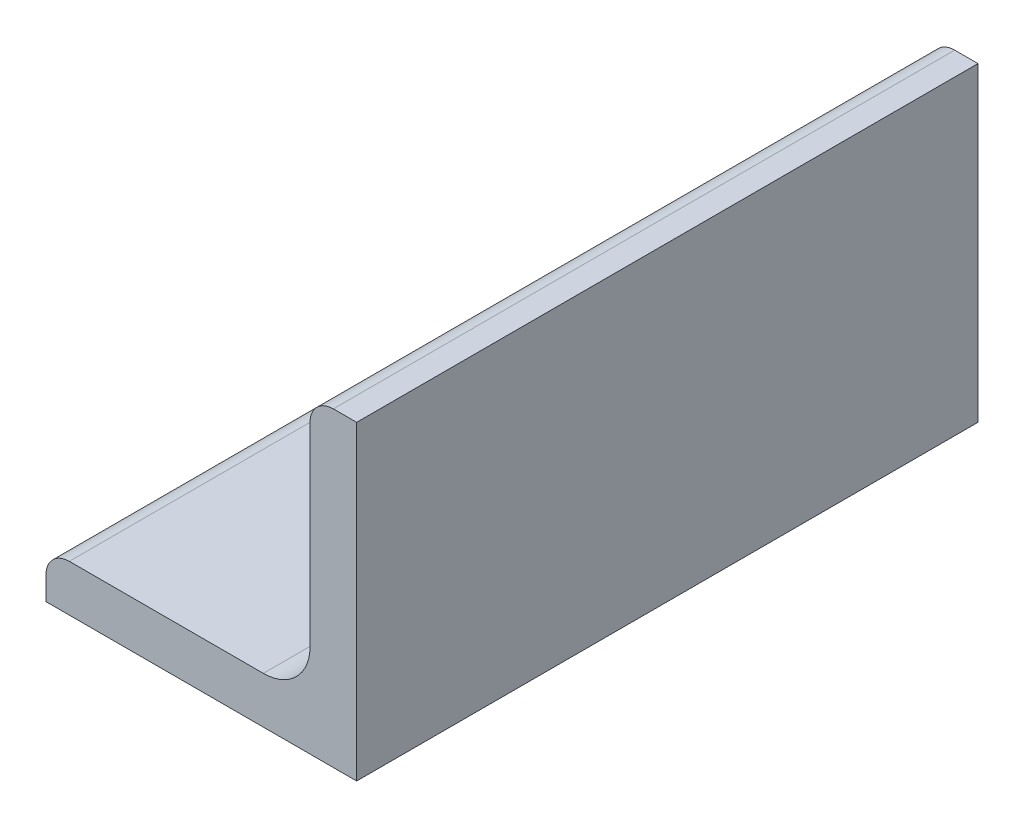
from build123d import *

# Parameters (mm, degrees)
BOSS_EXTRUDE1_DEPTH = 152.4
SKETCH3_W           = 32.781956778
SKETCH3_H           = 33.33928928
CUT_EXTRUDE1_DEPTH  = 241.3


with BuildPart() as part:
    # Sketch2 → Boss-Extrude1 (new, symmetric)
    with BuildSketch(Plane.XY):
        with BuildLine():
            Line((-15.875, -15.875), (15.875, -15.875))
            Line((15.875, -15.875), (15.875, 15.875))
            Line((15.875, 15.875), (13.49375, 15.875))
            ThreePointArc((13.49375, 15.875), (11.809951977, 15.177548023), (11.1125, 13.49375))
            Line((11.1125, 13.49375), (11.1125, -6.3373))
            ThreePointArc((11.1125, -6.3373), (9.713876302, -9.713876302), (6.3373, -11.1125))
            Line((6.3373, -11.1125), (-13.49375, -11.1125))
            ThreePointArc((-13.49375, -11.1125), (-15.177548023, -11.809951977), (-15.875, -13.49375))
            Line((-15.875, -13.49375), (-15.875, -15.875))
        make_face()
    extrude(amount=BOSS_EXTRUDE1_DEPTH, both=True)

    # Sketch3 → Cut-Extrude1 (cut)
    with BuildSketch(Plane(origin=(0, 0, -152.4), x_dir=(-1, 0, 0), z_dir=(0, 0, -1))):
        with Locations((0.515978389, 0.79464464)):
            Rectangle(SKETCH3_W, SKETCH3_H)
    extrude(amount=-CUT_EXTRUDE1_DEPTH, mode=Mode.SUBTRACT)


solid = part.part
